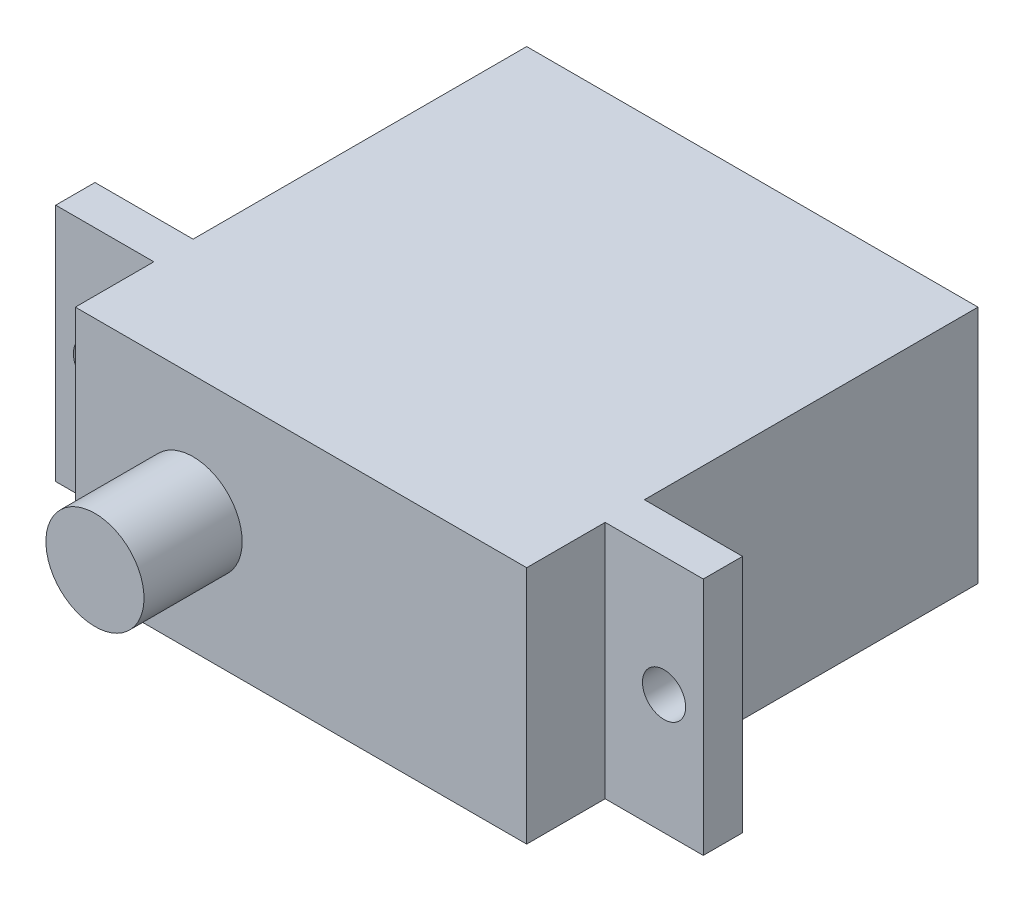
from build123d import *

# Parameters (mm, degrees)
CASE_23X12P2X23_START                = -19
CASE_23X12P2X23_PROFILE_W            = 23
CASE_23X12P2X23_PROFILE_H            = 12.2
CASE_23X12P2X23_DEPTH                = 23
MOUNTING_EARS_33X12P2_START          = -2
MOUNTING_EARS_33X12P2_PROFILE_W      = 33
MOUNTING_EARS_33X12P2_PROFILE_H      = 12.2
MOUNTING_EARS_33X12P2_DEPTH          = 2
OUTPUT_ENVELOPE_NOT_SPLINE_START     = 4
OUTPUT_ENVELOPE_NOT_SPLINE_PROFILE_R = 2.5
OUTPUT_ENVELOPE_NOT_SPLINE_DEPTH     = 5
MOUNTING_HOLES_NOMINAL_START         = -50
MOUNTING_HOLES_NOMINAL_PROFILE_R     = 1.1
MOUNTING_HOLES_NOMINAL_DEPTH         = 80.702020133


with BuildPart() as part:
    # Case_23x12p2x23_profile → Case_23x12p2x23 (new body)
    with BuildSketch(Plane.XY.offset(CASE_23X12P2X23_START)):
        with Locations((5.5, 0)):
            Rectangle(CASE_23X12P2X23_PROFILE_W, CASE_23X12P2X23_PROFILE_H)
    extrude(amount=CASE_23X12P2X23_DEPTH)

    # Mounting_ears_33x12p2_profile → Mounting_ears_33x12p2 (add)
    with BuildSketch(Plane.XY.offset(MOUNTING_EARS_33X12P2_START)):
        with Locations((5.5, 0)):
            Rectangle(MOUNTING_EARS_33X12P2_PROFILE_W, MOUNTING_EARS_33X12P2_PROFILE_H)
    extrude(amount=MOUNTING_EARS_33X12P2_DEPTH)

    # Output_envelope_not_spline_profile → Output_envelope_not_spline (add)
    with BuildSketch(Plane.XY.offset(OUTPUT_ENVELOPE_NOT_SPLINE_START)):
        Circle(OUTPUT_ENVELOPE_NOT_SPLINE_PROFILE_R)
    extrude(amount=OUTPUT_ENVELOPE_NOT_SPLINE_DEPTH)

    # Mounting_holes_nominal_profile → Mounting_holes_nominal (cut, through all)
    with BuildSketch(Plane.XY.offset(MOUNTING_HOLES_NOMINAL_START)):
        with Locations(Location((-9, 0, 0), (0, 0, 180))):
            Circle(MOUNTING_HOLES_NOMINAL_PROFILE_R)
        with Locations(Location((20, 0, 0), (0, 0, 180))):
            Circle(MOUNTING_HOLES_NOMINAL_PROFILE_R)
    extrude(amount=MOUNTING_HOLES_NOMINAL_DEPTH, mode=Mode.SUBTRACT)


solid = part.part
